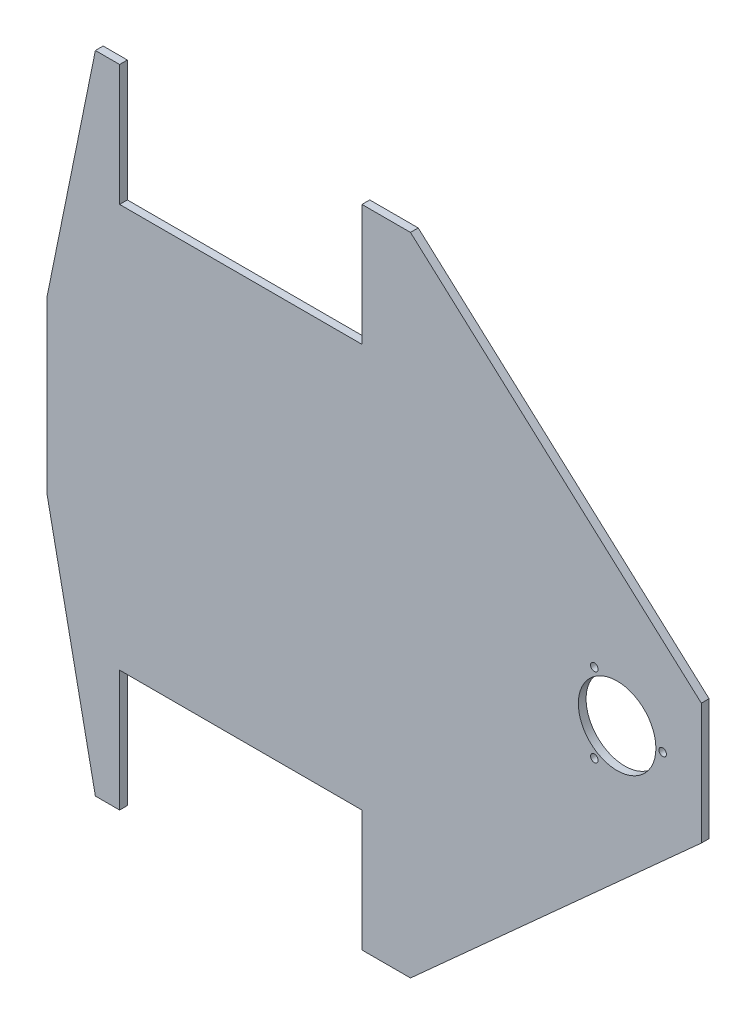
from build123d import *

# Parameters (mm, degrees)
EXTRUDE_1_DEPTH         = 3.2
SKETCH_4_R              = 16
CUT_EXTRUDE_1_DEPTH     = 6
HOLE_WIZARD_3_1_3_1_4_D = 3.1


with BuildPart() as part:
    # Эскиз1 → Бобышка-Вытянуть1 (new body)
    with BuildSketch(Plane.XY):
        Polygon((50, -3.2), (-50, -3.2), (-50, -53.2), (-60, -53.2), (-80, 45), (-80, 115), (-60, 213.2), (-50, 213.2), (-50, 163.2), (50, 163.2), (50, 213.2), (70, 213.2), (190, 105), (190, 55), (70, -53.2), (50, -53.2), align=None)
    extrude(amount=EXTRUDE_1_DEPTH)

    # Эскиз4 → Вырез-Вытянуть1 (cut)
    with BuildSketch(Plane.XY.offset(3.2)):
        with Locations((155.25, 79.5275375)):
            Circle(SKETCH_4_R)
    extrude(amount=-CUT_EXTRUDE_1_DEPTH, mode=Mode.SUBTRACT)

    # Диаметр отверстия Ø3.1 (3.1)4 (through all)
    with Locations(Plane(origin=(0, 0, 0), x_dir=(-1, 0, 0), z_dir=(0, 0, -1))):
        with Locations((-145.85, 95.808815091), (-145.85, 63.246259909), (-174.05, 79.5275375)):
            Hole(HOLE_WIZARD_3_1_3_1_4_D / 2)


solid = part.part
